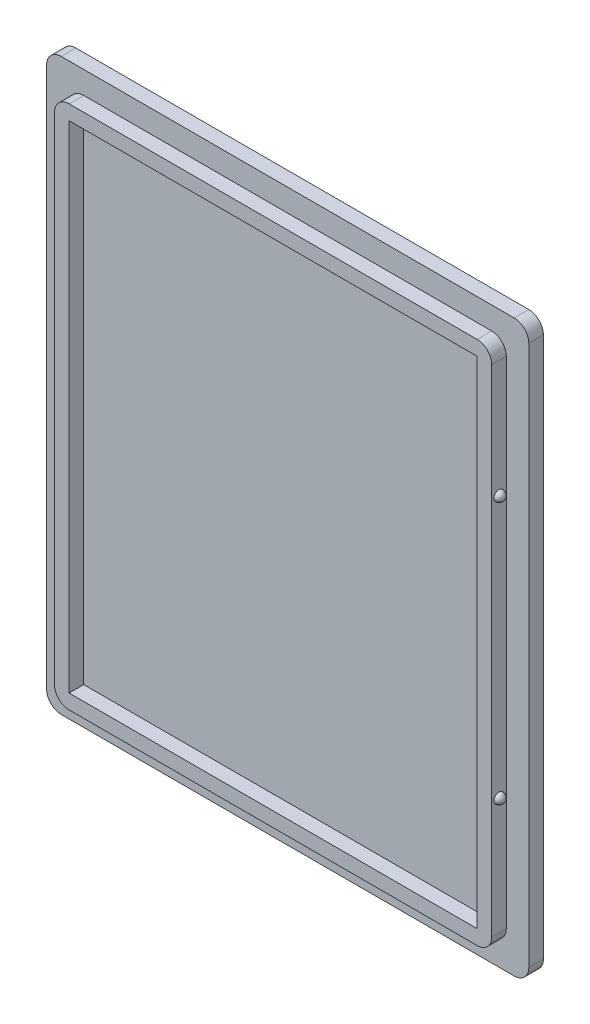
from build123d import *

# Parameters (mm, degrees)
ESQUISSE1_W            = 39
ESQUISSE1_H            = 33
BOSS_EXTRU_1_DEPTH     = 1
ESQUISSE2_W            = 29.92
ESQUISSE2_H            = 35.92
ESQUISSE2_W_2          = 27.92
ESQUISSE2_H_2          = 33.92
BOSS_EXTRU_2_DEPTH     = 1
R_VOLUTION2_ANGLE      = 180
SYM_TRIE2_COPY_1_ANGLE = 180
CONG_1_R               = 1
CONG_2_R               = 1


with BuildPart() as part:
    # Esquisse1 → Boss.-Extru.1 (new body)
    with BuildSketch(Plane(origin=(0, 0, 0), x_dir=(0, 1, 0), z_dir=(0, 0, 1))):
        Rectangle(ESQUISSE1_W, ESQUISSE1_H)
    extrude(amount=BOSS_EXTRU_1_DEPTH)

    # Esquisse2 → Boss.-Extru.2 (add)
    with BuildSketch(Plane.XY.offset(1)):
        Rectangle(ESQUISSE2_W, ESQUISSE2_H)
        Rectangle(ESQUISSE2_W_2, ESQUISSE2_H_2, mode=Mode.SUBTRACT)
    extrude(amount=BOSS_EXTRU_2_DEPTH)

    # Esquisse3 → Révolution2 (revolve)
    with BuildSketch(Plane.YZ.offset(14.96)):
        with BuildLine():
            Line((-9.31, 1.5), (-8.61, 1.5))
            ThreePointArc((-8.61, 1.5), (-8.96, 1.85), (-9.31, 1.5))
        make_face()
    r_volution2 = revolve(axis=Axis((14.96, -17.96, 1.5), (0, 1, 0)), revolution_arc=R_VOLUTION2_ANGLE)

    # Symétrie1: Révolution2 across plane
    add(r_volution2.mirror(Plane.ZX))

    # Symétrie2: Révolution2 across plane
    add(r_volution2.mirror(Plane(origin=(0, 0, 0), x_dir=(0, 0, 1), z_dir=(1, 0, 0))))

    # Symétrie2 copy 1 sketch → Symétrie2 copy 1 (revolve)
    with BuildSketch(Plane(origin=(-14.96, 0, 0), x_dir=(0, -1, 0), z_dir=(-1, 0, 0))):
        with BuildLine():
            Line((-9.31, 1.5), (-8.61, 1.5))
            ThreePointArc((-8.61, 1.5), (-8.96, 1.85), (-9.31, 1.5))
        make_face()
    revolve(axis=Axis((-14.96, 17.96, 1.5), (0, -1, 0)), revolution_arc=SYM_TRIE2_COPY_1_ANGLE)

    # Congé1
    cong_1_edges = [part.edges().sort_by_distance(p)[0] for p in [
        (16.5, 19.5, 0.5),
        (16.5, -19.5, 0.5),
        (-16.5, -19.5, 0.5),
        (-16.5, 19.5, 0.5),
    ]]
    fillet(cong_1_edges, radius=CONG_1_R)

    # Congé2
    cong_2_edges = [part.edges().sort_by_distance(p)[0] for p in [
        (14.96, 17.96, 1.5),
        (-14.96, 17.96, 1.5),
        (-14.96, -17.96, 1.5),
        (14.96, -17.96, 1.5),
    ]]
    fillet(cong_2_edges, radius=CONG_2_R)


solid = part.part
